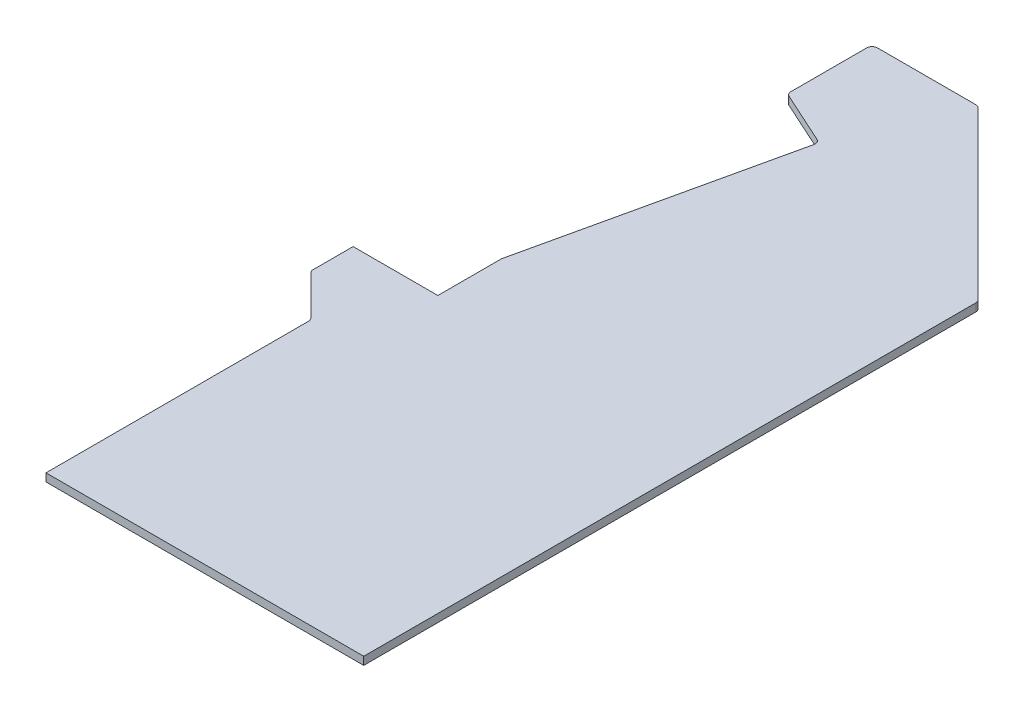
from build123d import *

# Parameters (mm, degrees)
BOSS_EXTRUDE1_DEPTH = 19.05


with BuildPart() as part:
    # Sketch1 → Boss-Extrude1 (new body)
    with BuildSketch(Plane(origin=(0, 0, 0), x_dir=(1, 0, 0), z_dir=(0, 1, 0))):
        with BuildLine():
            Line((-108.53449825, -3.903212814), (-108.53449825, 1464.036274944))
            ThreePointArc((-108.53449825, 1464.036274944), (-109.501228187, 1468.896354535), (-112.254242128, 1473.016531065))
            Line((-112.254242128, 1473.016531065), (-511.214754371, 1871.977043307))
            ThreePointArc((-511.214754371, 1871.977043307), (-515.334930901, 1874.730057249), (-520.195010492, 1875.696787186))
            Line((-520.195010492, 1875.696787186), (-756.23449825, 1875.696787186))
            ThreePointArc((-756.23449825, 1875.696787186), (-765.214754371, 1871.977043307), (-768.93449825, 1862.996787186))
            Line((-768.93449825, 1862.996787186), (-768.93449825, 1680.674485719))
            ThreePointArc((-768.93449825, 1680.674485719), (-766.912332227, 1673.798886723), (-761.489795642, 1669.112831455))
            Line((-761.489795642, 1669.112831455), (-638.63184093, 1613.268306586))
            ThreePointArc((-638.63184093, 1613.268306586), (-632.516703345, 1607.363790151), (-631.495541921, 1598.924865375))
            Line((-631.495541921, 1598.924865375), (-768.93449825, 986.696787186))
            Line((-768.93449825, 986.696787186), (-768.93449825, 834.296787186))
            Line((-768.93449825, 834.296787186), (-972.13449825, 834.296787186))
            Line((-972.13449825, 834.296787186), (-972.13449825, 737.957299428))
            ThreePointArc((-972.13449825, 737.957299428), (-971.167768312, 733.097219837), (-968.414754371, 728.977043307))
            Line((-968.414754371, 728.977043307), (-874.254242128, 634.816531065))
            ThreePointArc((-874.254242128, 634.816531065), (-871.501228187, 630.696354535), (-870.53449825, 625.836274944))
            Line((-870.53449825, 625.836274944), (-870.53449825, -3.903212814))
            Line((-870.53449825, -3.903212814), (-108.53449825, -3.903212814))
        make_face()
    extrude(amount=BOSS_EXTRUDE1_DEPTH)


solid = part.part
